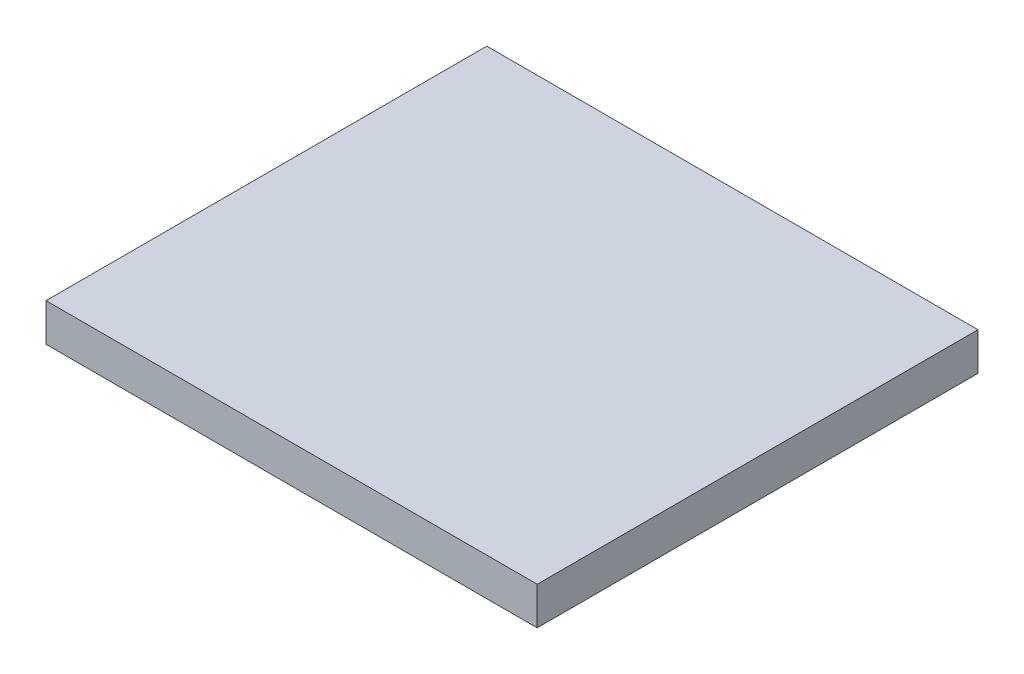
from build123d import *

# Parameters (mm, degrees)
SKETCH1_W           = 78
SKETCH1_H           = 70
BOSS_EXTRUDE1_DEPTH = 6


with BuildPart() as part:
    # Sketch1 → Boss-Extrude1 (new body)
    with BuildSketch(Plane(origin=(0, 0, 0), x_dir=(1, 0, 0), z_dir=(0, 1, 0))):
        with Locations((-150.943820225, 17.5)):
            Rectangle(SKETCH1_W, SKETCH1_H)
    extrude(amount=BOSS_EXTRUDE1_DEPTH)


solid = part.part
